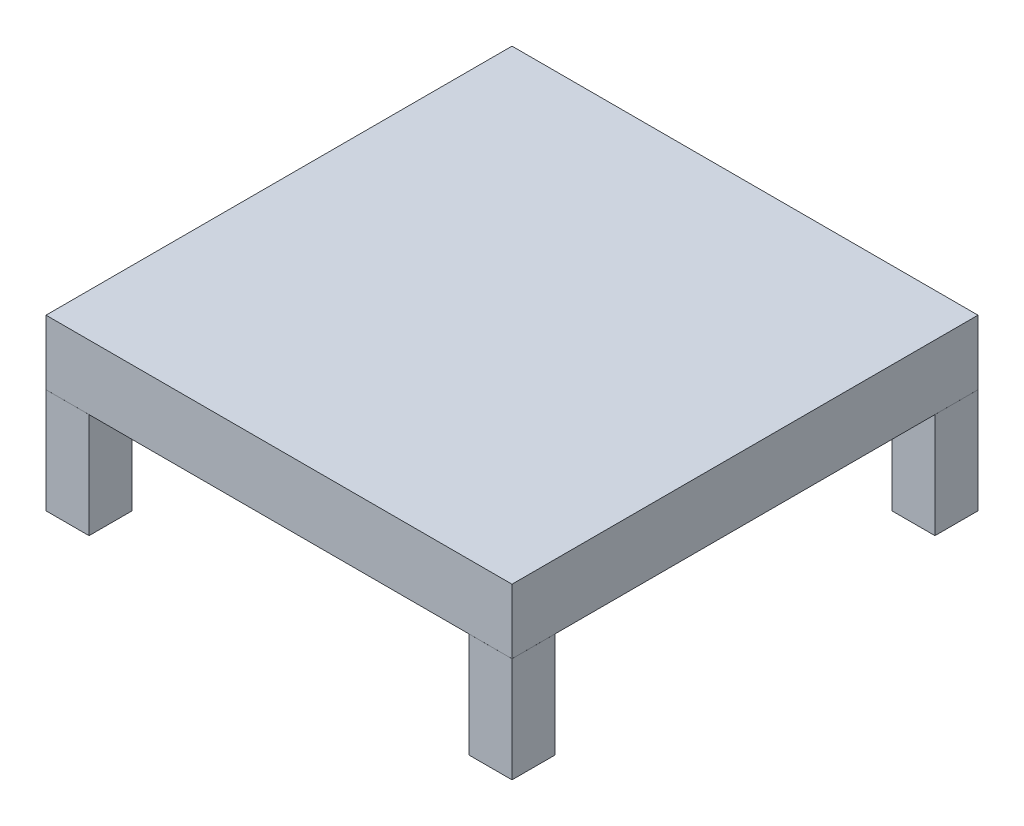
from build123d import *

# Parameters (mm, degrees)
SKETCH3_W               = 550
SKETCH3_H               = 550
BOSS_EXTRUDE2_DEPTH     = 38.1
SKETCH5_W               = 50.8
SKETCH5_H               = 50.8
BOSS_EXTRUDE3_DEPTH     = 373.8
CUT_EXTRUDE1_DEPTH      = 741.126077098
CUT_EXTRUDE1_DEPTH_BACK = 741.126077098
SKETCH6_W               = 655.630835137
SKETCH6_H               = 0.0254
SKETCH7_W               = 550
SKETCH7_H               = 550
CUT_EXTRUDE2_DEPTH      = 249.975
SKETCH8_R               = 1.995991075
SKETCH8_R_2             = 1.996000028
CUT_EXTRUDE3_DEPTH      = 2.4765


with BuildPart() as part:
    # Sketch3 → Boss-Extrude2 (new, symmetric)
    with BuildSketch(Plane(origin=(0, 0, 0), x_dir=(1, 0, 0), z_dir=(0, 1, 0))):
        Rectangle(SKETCH3_W, SKETCH3_H)
    extrude(amount=BOSS_EXTRUDE2_DEPTH, both=True)

    # Sketch5 → Boss-Extrude3 (add)
    with BuildSketch(Plane.XZ.offset(38.1)):
        with Locations((249.6, 249.6)):
            Rectangle(SKETCH5_W, SKETCH5_H)
        with Locations((249.6, -249.6)):
            Rectangle(SKETCH5_W, SKETCH5_H)
        with Locations((-249.6, -249.6)):
            Rectangle(SKETCH5_W, SKETCH5_H)
        with Locations((-249.6, 249.6)):
            Rectangle(SKETCH5_W, SKETCH5_H)
    extrude(amount=BOSS_EXTRUDE3_DEPTH)

    # Sketch6 → Cut-Extrude1 (cut, two sides: drawn at the far end of the back side and taken through both)
    with BuildSketch(Plane(origin=(275, 0, 0), x_dir=(0, 0, -1), z_dir=(1, 0, 0)).offset(-CUT_EXTRUDE1_DEPTH_BACK)):
        with Locations((32.666920981, -38.1127)):
            Rectangle(SKETCH6_W, SKETCH6_H)
    extrude(amount=CUT_EXTRUDE1_DEPTH + CUT_EXTRUDE1_DEPTH_BACK, mode=Mode.SUBTRACT)


with BuildPart() as cut_extrude1_piece_1:
    # of the separate pieces the step leaves, piece 1, a body of its own (cut_extrude1_pieces)
    add(part.part.solids().sort_by_distance((-275, -38.1, -275))[0])

    # Sketch8 → Cut-Extrude3 (cut)
    with BuildSketch(Plane.XZ.offset(38.1)):
        with Locations(Location((161.147032428, 142.922948736, 0), (0, 0, 270))):
            Circle(SKETCH8_R)
        with Locations(Location((75.271738487, -43.7903374, 0), (0, 0, 270))):
            Circle(SKETCH8_R_2)
    extrude(amount=-CUT_EXTRUDE3_DEPTH, mode=Mode.SUBTRACT)


with BuildPart() as cut_extrude1_piece_2:
    # of the separate pieces the step leaves, piece 2, a body of its own (cut_extrude1_pieces)
    add(part.part.solids().sort_by_distance((275, -38.1254, 224.2))[0])


with BuildPart() as cut_extrude1_piece_3:
    # of the separate pieces the step leaves, piece 3, a body of its own (cut_extrude1_pieces)
    add(part.part.solids().sort_by_distance((-275, -411.9, 275))[0])


with BuildPart() as cut_extrude1_piece_4:
    # of the separate pieces the step leaves, piece 4, a body of its own (cut_extrude1_pieces)
    add(part.part.solids().sort_by_distance((-275, -411.9, -275))[0])


with BuildPart() as cut_extrude1_piece_5:
    # of the separate pieces the step leaves, piece 5, a body of its own (cut_extrude1_pieces)
    add(part.part.solids().sort_by_distance((224.2, -38.1254, -275))[0])


with BuildPart() as cut_extrude2_tool:
    # Sketch7 → Cut-Extrude2 (new body)
    with BuildSketch(Plane.XZ.offset(411.9)):
        Rectangle(SKETCH7_W, SKETCH7_H)
    extrude(amount=-CUT_EXTRUDE2_DEPTH)


with BuildPart() as cut_extrude1_piece_2_1:
    add(cut_extrude1_piece_2.part)

    # Cut-Extrude2: cut by cut_extrude2_tool
    add(cut_extrude2_tool.part, mode=Mode.SUBTRACT)


with BuildPart() as cut_extrude1_piece_3_1:
    add(cut_extrude1_piece_3.part)

    # Cut-Extrude2: cut by cut_extrude2_tool
    add(cut_extrude2_tool.part, mode=Mode.SUBTRACT)


with BuildPart() as cut_extrude1_piece_4_1:
    add(cut_extrude1_piece_4.part)

    # Cut-Extrude2: cut by cut_extrude2_tool
    add(cut_extrude2_tool.part, mode=Mode.SUBTRACT)


with BuildPart() as cut_extrude1_piece_5_1:
    add(cut_extrude1_piece_5.part)

    # Cut-Extrude2: cut by cut_extrude2_tool
    add(cut_extrude2_tool.part, mode=Mode.SUBTRACT)


solid = Compound([cut_extrude1_piece_1.part, cut_extrude1_piece_2_1.part, cut_extrude1_piece_3_1.part, cut_extrude1_piece_4_1.part, cut_extrude1_piece_5_1.part])
